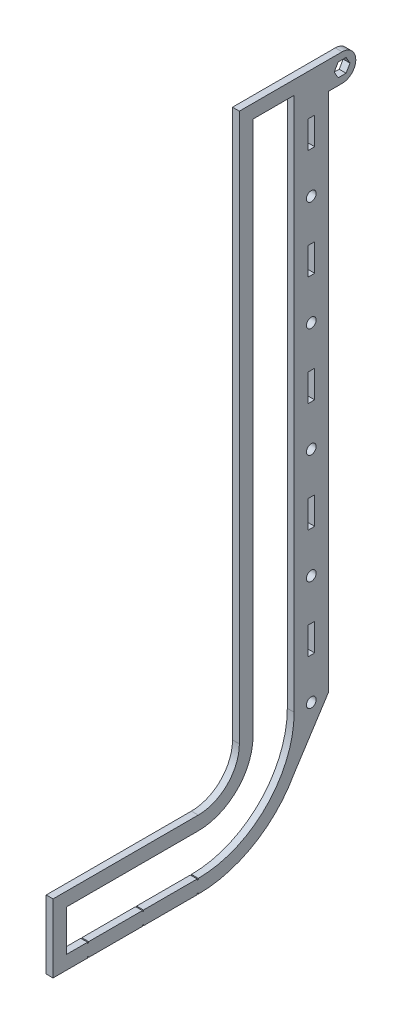
from build123d import *

# Parameters (mm, degrees)
SKETCH2_R           = 2.2606
SKETCH2_W           = 3.175
SKETCH2_H           = 12.7
BOSS_EXTRUDE1_DEPTH = 3.175


with BuildPart() as part:
    # Sketch2 → Boss-Extrude1 (new body)
    with BuildSketch(Plane(origin=(0, 0, 0), x_dir=(0, 0, -1), z_dir=(1, 0, 0))):
        with BuildLine():
            Line((15.875, 254), (22.225, 254))
            ThreePointArc((22.225, 254), (28.575, 247.65), (22.225, 241.3))
            Line((22.225, 241.3), (15.875, 241.3))
            Line((15.875, 241.3), (15.875, 0))
            Line((15.875, 0), (0, -24.593444248))
            ThreePointArc((0, -24.593444248), (-18.649873719, -43.760638523), (-44.45, -50.8))
            Line((-44.45, -50.8), (-44.45, -50.292))
            Line((-44.45, -50.292), (-44.958, -50.292))
            Line((-44.958, -50.292), (-44.958, -50.8))
            Line((-44.958, -50.8), (-69.85, -50.8))
            Line((-69.85, -50.8), (-69.85, -50.292))
            Line((-69.85, -50.292), (-70.358, -50.292))
            Line((-70.358, -50.292), (-70.358, -50.8))
            Line((-70.358, -50.8), (-95.25, -50.8))
            Line((-95.25, -50.8), (-95.25, -50.292))
            Line((-95.25, -50.292), (-95.758, -50.292))
            Line((-95.758, -50.292), (-95.758, -50.8))
            Line((-95.758, -50.8), (-111.76, -50.8))
            Line((-111.76, -50.8), (-111.76, -44.45))
            Line((-111.76, -44.45), (-111.76, -25.4))
            Line((-111.76, -25.4), (-111.76, -19.05))
            Line((-111.76, -19.05), (-44.45, -19.05))
            ThreePointArc((-44.45, -19.05), (-30.979615818, -13.470384182), (-25.4, 0))
            Line((-25.4, 0), (-25.4, 247.65))
            Line((-25.4, 247.65), (-25.4, 254))
            Line((-25.4, 254), (0, 254))
            Line((0, 254), (15.875, 254))
        make_face()
        with Locations((7.9375, 0)):
            Circle(SKETCH2_R, mode=Mode.SUBTRACT)
        with Locations((7.9375, 50.8)):
            Circle(SKETCH2_R, mode=Mode.SUBTRACT)
        with Locations((7.9375, 101.6)):
            Circle(SKETCH2_R, mode=Mode.SUBTRACT)
        with Locations((7.9375, 152.4)):
            Circle(SKETCH2_R, mode=Mode.SUBTRACT)
        with Locations((7.9375, 203.2)):
            Circle(SKETCH2_R, mode=Mode.SUBTRACT)
        with BuildLine():
            Line((-44.958, -44.45), (-69.85, -44.45))
            Line((-69.85, -44.45), (-69.85, -44.958))
            Line((-69.85, -44.958), (-70.358, -44.958))
            Line((-70.358, -44.958), (-70.358, -44.45))
            Line((-70.358, -44.45), (-95.25, -44.45))
            Line((-95.25, -44.45), (-95.25, -44.958))
            Line((-95.25, -44.958), (-95.758, -44.958))
            Line((-95.758, -44.958), (-95.758, -44.45))
            Line((-95.758, -44.45), (-105.41, -44.45))
            Line((-105.41, -44.45), (-105.41, -25.4))
            Line((-105.41, -25.4), (-44.45, -25.4))
            ThreePointArc((-44.45, -25.4), (-26.489487758, -17.960512242), (-19.05, 0))
            Line((-19.05, 0), (-19.05, 247.65))
            Line((-19.05, 247.65), (0, 247.65))
            Line((0, 247.65), (0, 0))
            ThreePointArc((0, 0), (-13.019103576, -31.430896424), (-44.45, -44.45))
            Line((-44.45, -44.45), (-44.45, -44.958))
            Line((-44.45, -44.958), (-44.958, -44.958))
            Line((-44.958, -44.958), (-44.958, -44.45))
        make_face(mode=Mode.SUBTRACT)
        with Locations((7.9375, 228.6)):
            Rectangle(SKETCH2_W, SKETCH2_H, mode=Mode.SUBTRACT)
        with Locations((7.9375, 177.8)):
            Rectangle(SKETCH2_W, SKETCH2_H, mode=Mode.SUBTRACT)
        with Locations((7.9375, 76.2)):
            Rectangle(SKETCH2_W, SKETCH2_H, mode=Mode.SUBTRACT)
        with Locations((7.9375, 127)):
            Rectangle(SKETCH2_W, SKETCH2_H, mode=Mode.SUBTRACT)
        with Locations((7.9375, 25.4)):
            Rectangle(SKETCH2_W, SKETCH2_H, mode=Mode.SUBTRACT)
        Polygon((25.8826, 247.65), (24.0538, 250.825), (20.3962, 250.825), (18.5674, 247.65), (20.3962, 244.505584275), (24.0538, 244.505584275), align=None, mode=Mode.SUBTRACT)
    extrude(amount=BOSS_EXTRUDE1_DEPTH)


solid = part.part
